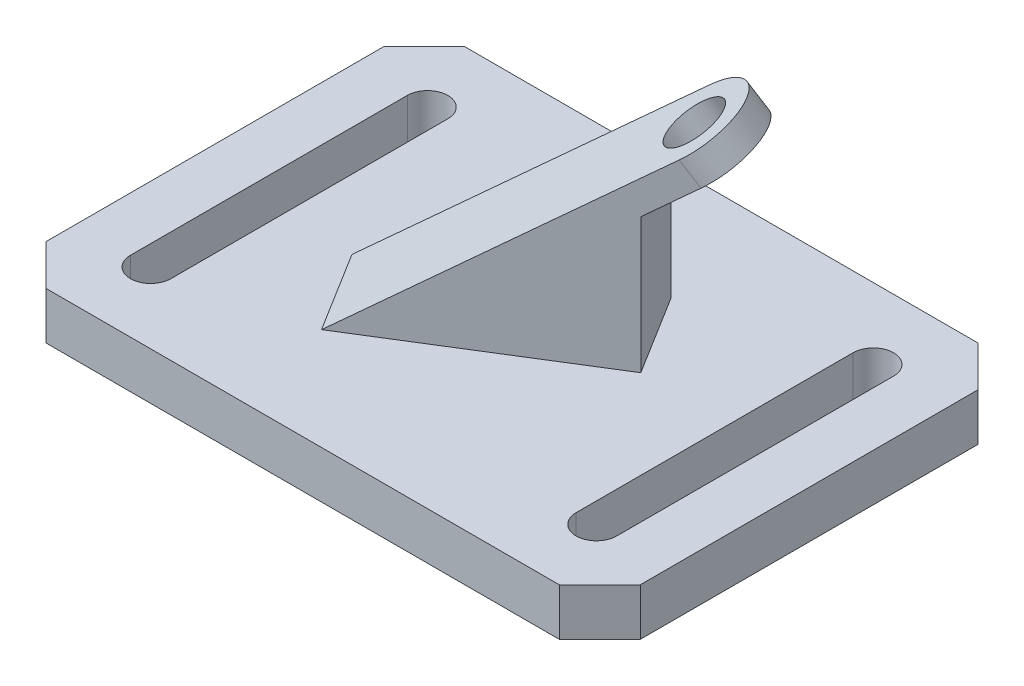
from build123d import *

# Parameters (mm, degrees)
BOSS_EXTRUDE1_DEPTH = 7
BOSS_EXTRUDE2_DEPTH = 7
SKETCH4_R           = 4
BOSS_EXTRUDE3_DEPTH = 4


with BuildPart() as part:
    # Sketch1 → Boss-Extrude1 (new body)
    with BuildSketch(Plane(origin=(0, 0, 0), x_dir=(1, 0, 0), z_dir=(0, 1, 0))):
        Polygon((38, 31), (-38, 31), (-44, 25), (-44, -25), (-38, -31), (38, -31), (44, -25), (44, 25), align=None)
        with BuildLine():
            Line((-36, -20.5), (-36, 20.5))
            ThreePointArc((-36, 20.5), (-33, 23.5), (-30, 20.5))
            Line((-30, 20.5), (-30, -20.5))
            ThreePointArc((-30, -20.5), (-33, -23.5), (-36, -20.5))
        make_face(mode=Mode.SUBTRACT)
        with BuildLine():
            Line((30, -20.5), (30, 20.5))
            ThreePointArc((30, 20.5), (33, 23.5), (36, 20.5))
            Line((36, 20.5), (36, -20.5))
            ThreePointArc((36, -20.5), (33, -23.5), (30, -20.5))
        make_face(mode=Mode.SUBTRACT)
    extrude(amount=BOSS_EXTRUDE1_DEPTH)

    # Sketch3 → Boss-Extrude2 (add, symmetric)
    with BuildSketch(Plane(origin=(0, 0, 0), x_dir=(0.8494412510349073, 0, -0.5276832014004725), z_dir=(0.5276832014004725, 0, 0.8494412510349073))):
        Polygon((-12.043860446, 7), (15.483777963, 27), (15.483777963, 7), align=None)
    extrude(amount=BOSS_EXTRUDE2_DEPTH, both=True)

    # Sketch4 → Boss-Extrude3 (add)
    with BuildSketch(Plane(origin=(-6.362101975, 10.30875546, 3.952214863), x_dir=(0.8664354877824213, 0.4662012627589442, 0.17873423878262268), z_dir=(-0.49928904004718316, 0.8090169943749507, 0.31016440366567427))):
        with BuildLine():
            Line((-13.486874593, -1.530456574), (24.604923104, 27.718726833))
            ThreePointArc((24.604923104, 27.718726833), (34.42015965, 26.42987791), (33.131310727, 16.614641364))
            Line((33.131310727, 16.614641364), (-4.960486969, -12.634542043))
            Line((-4.960486969, -12.634542043), (-13.486874593, -1.530456574))
        make_face()
        with Locations((28.868116916, 22.166684098)):
            Circle(SKETCH4_R, mode=Mode.SUBTRACT)
    extrude(amount=BOSS_EXTRUDE3_DEPTH)


solid = part.part
